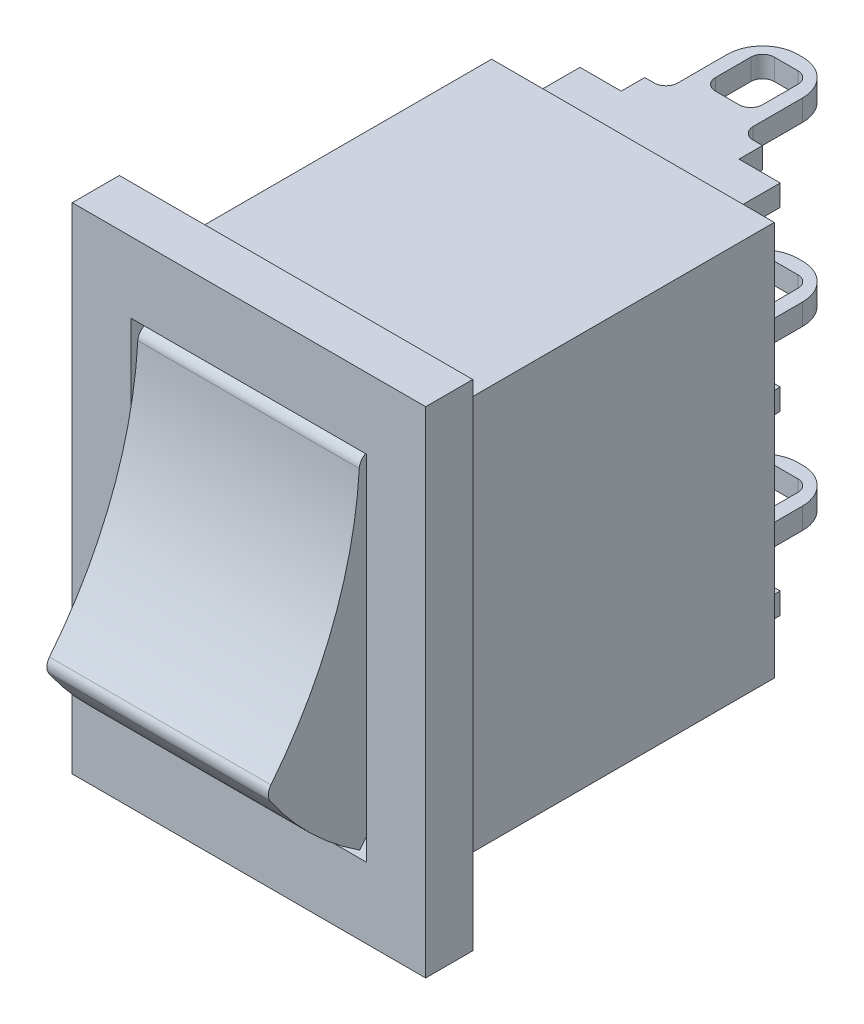
from build123d import *

# Parameters (mm, degrees)
ESBO_O1_W                     = 12
ESBO_O1_H                     = 16.75
RESSALTO_EXTRUS_O1_DEPTH      = 14.3
ESBO_O2_W                     = 15
ESBO_O2_H                     = 21
RESSALTO_EXTRUS_O2_DEPTH      = 2
ESBO_O3_W                     = 10
ESBO_O3_H                     = 15
CORTE_EXTRUS_O1_DEPTH         = 10
RESSALTO_EXTRUS_O3_DEPTH      = 4.7
RESSALTO_EXTRUS_O3_DEPTH_BACK = 4.7
FILETE1_R                     = 0.5
ESBO_O5_W                     = 8.5
ESBO_O5_H                     = 0.9
RESSALTO_EXTRUS_O4_DEPTH      = 7.1
CORTE_EXTRUS_O2_DEPTH         = 24.950891393
CORTE_EXTRUS_O2_DEPTH_BACK    = 24.950891393


with BuildPart() as part:
    # Esboço1 → Ressalto-extrusão1 (new body)
    with BuildSketch(Plane.XY):
        Rectangle(ESBO_O1_W, ESBO_O1_H)
    extrude(amount=RESSALTO_EXTRUS_O1_DEPTH)

    # Esboço2 → Ressalto-extrusão2 (add)
    with BuildSketch(Plane.XY.offset(14.3)):
        Rectangle(ESBO_O2_W, ESBO_O2_H)
    extrude(amount=RESSALTO_EXTRUS_O2_DEPTH)

    # Esboço3 → Corte-extrusão1 (cut)
    with BuildSketch(Plane.XY.offset(16.3)):
        Rectangle(ESBO_O3_W, ESBO_O3_H)
    extrude(amount=-CORTE_EXTRUS_O1_DEPTH, mode=Mode.SUBTRACT)

    # Esboço4 → Ressalto-extrusão3 (add, two sides: drawn at the far end of the back side and taken through both)
    with BuildSketch(Plane(origin=(0, 0, 0), x_dir=(0, 0, -1), z_dir=(1, 0, 0)).offset(-RESSALTO_EXTRUS_O3_DEPTH_BACK)):
        with BuildLine():
            ThreePointArc((-10.650515464, 7.488659794), (-12.165645544, -0.359367098), (-16.3, -7.2))
            ThreePointArc((-16.3, -7.2), (-18.509688847, -5.409688847), (-20.3, -3.2))
            ThreePointArc((-20.3, -3.2), (-17.43047856, 1.665568677), (-16.3, 7.2))
            ThreePointArc((-16.3, 7.2), (-13.490389917, 7.640488371), (-10.650515464, 7.488659794))
        make_face()
    extrude(amount=RESSALTO_EXTRUS_O3_DEPTH + RESSALTO_EXTRUS_O3_DEPTH_BACK)

    # Filete1
    filete1_edges = [part.edges().sort_by_distance(p)[0] for p in [
        (0, 7.2, 16.3),
        (0, -3.2, 20.3),
    ]]
    fillet(filete1_edges, radius=FILETE1_R)

    # Esboço5 → Ressalto-extrusão4 (add)
    with BuildSketch(Plane(origin=(0, 0, 0), x_dir=(-1, 0, 0), z_dir=(0, 0, -1))):
        Rectangle(ESBO_O5_W, ESBO_O5_H)
        with Locations((0, -7.5)):
            Rectangle(ESBO_O5_W, ESBO_O5_H)
        with Locations((0, 7.5)):
            Rectangle(ESBO_O5_W, ESBO_O5_H)
    extrude(amount=RESSALTO_EXTRUS_O4_DEPTH)

    # Esboço7 → Corte-extrusão2 (cut, two sides: drawn at the far end of the back side and taken through both)
    with BuildSketch(Plane(origin=(0, 0, 0), x_dir=(1, 0, 0), z_dir=(0, 1, 0)).offset(-CORTE_EXTRUS_O2_DEPTH_BACK)):
        with BuildLine():
            Line((2.5, 2), (4.25, 2))
            Line((4.25, 2), (4.25, 7.1))
            Line((4.25, 7.1), (0.1, 7.1))
            ThreePointArc((0.1, 7.1), (1.160660172, 6.660660172), (1.6, 5.6))
            Line((1.6, 5.6), (1.6, 3.5))
            ThreePointArc((1.6, 3.5), (1.746446609, 3.146446609), (2.1, 3))
            Line((2.1, 3), (2.5, 3))
            Line((2.5, 3), (2.5, 2))
        make_face()
        with BuildLine():
            Line((-4.25, 7.1), (-4.25, 2))
            Line((-4.25, 2), (-2.5, 2))
            Line((-2.5, 2), (-2.5, 3))
            Line((-2.5, 3), (-2.1, 3))
            ThreePointArc((-2.1, 3), (-1.746446609, 3.146446609), (-1.6, 3.5))
            Line((-1.6, 3.5), (-1.6, 5.6))
            ThreePointArc((-1.6, 5.6), (-1.160660172, 6.660660172), (-0.1, 7.1))
            Line((-0.1, 7.1), (-4.25, 7.1))
        make_face()
        with BuildLine():
            ThreePointArc((0.5, 6.5), (0.853553391, 6.353553391), (1, 6))
            Line((1, 6), (1, 4.5))
            ThreePointArc((1, 4.5), (0.853553391, 4.146446609), (0.5, 4))
            Line((0.5, 4), (-0.5, 4))
            ThreePointArc((-0.5, 4), (-0.853553391, 4.146446609), (-1, 4.5))
            Line((-1, 4.5), (-1, 6))
            ThreePointArc((-1, 6), (-0.853553391, 6.353553391), (-0.5, 6.5))
            Line((-0.5, 6.5), (0.5, 6.5))
        make_face()
    extrude(amount=CORTE_EXTRUS_O2_DEPTH + CORTE_EXTRUS_O2_DEPTH_BACK, mode=Mode.SUBTRACT)


solid = part.part
